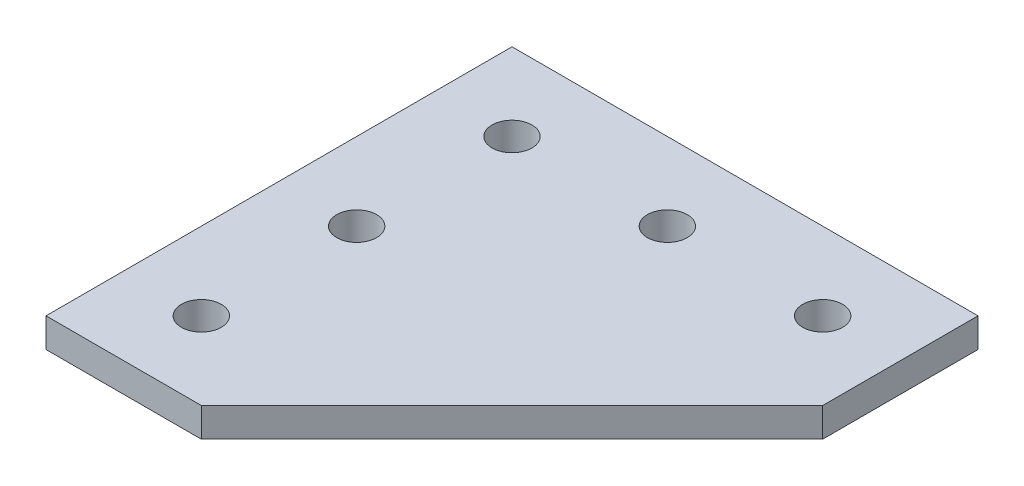
from build123d import *

# Parameters (mm, degrees)
SKETCH1_R           = 3.2639
BOSS_EXTRUDE1_DEPTH = 4.7752


with BuildPart() as part:
    # Sketch1 (on Top Plane) → Boss-Extrude1 (new body)
    with BuildSketch(Plane(origin=(0, 0, 0), x_dir=(1, 0, 0), z_dir=(0, 1, 0))):
        Polygon((-76.2, 0), (-76.2, -76.2), (-50.8, -76.2), (0, -25.4), (0, 0), align=None)
        with Locations(Location((-63.5, -63.5, 0), (0, 0, 90))):
            Circle(SKETCH1_R, mode=Mode.SUBTRACT)
        with Locations(Location((-63.5, -38.1, 0), (0, 0, 90))):
            Circle(SKETCH1_R, mode=Mode.SUBTRACT)
        with Locations(Location((-63.5, -12.7, 0), (0, 0, 90))):
            Circle(SKETCH1_R, mode=Mode.SUBTRACT)
        with Locations(Location((-38.1, -12.7, 0), (0, 0, 90))):
            Circle(SKETCH1_R, mode=Mode.SUBTRACT)
        with Locations(Location((-12.7, -12.7, 0), (0, 0, 90))):
            Circle(SKETCH1_R, mode=Mode.SUBTRACT)
    extrude(amount=-BOSS_EXTRUDE1_DEPTH)


solid = part.part
